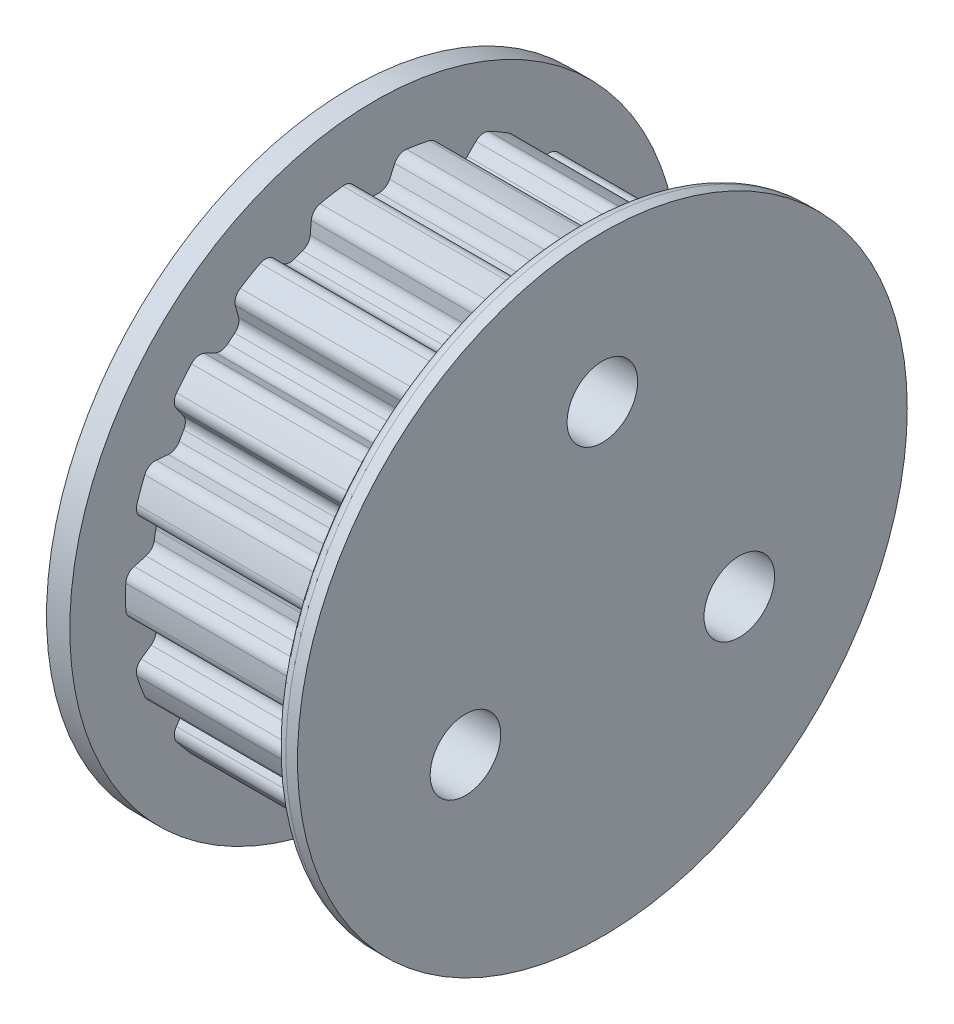
from build123d import *

# Parameters (mm, degrees)
SKETCH3_R                = 13.403127996
BOSS_EXTRUDE1_DEPTH      = 5.5
CUT_EXTRUDE1_DEPTH       = 5.5
FILLET1_R                = 0.61
CIRPATTERN1_COUNT        = 18
FILLET1_OF_CIRPATTERN1_R = 0.61
BOSS_EXTRUDE4_START      = 5.5
SKETCH8_R                = 16.403127996
BOSS_EXTRUDE4_DEPTH      = 1.25
BOSS_EXTRUDE5_START      = -6.75
SKETCH8_2_R              = 16.403127996
BOSS_EXTRUDE5_DEPTH      = 1.25
FILLET2_R                = 0.625
SKETCH10_R               = 6.35
CUT_EXTRUDE3_DEPTH       = 3.175
F_6_CLEARANCE_HOLE1_D    = 3.7973


with BuildPart() as part:
    # Sketch3 → Boss-Extrude1 (new, symmetric)
    with BuildSketch(Plane(origin=(0, 0, 0), x_dir=(0, 0, -1), z_dir=(1, 0, 0))):
        Circle(SKETCH3_R)
    extrude(amount=BOSS_EXTRUDE1_DEPTH, both=True)

    # Sketch4 → Cut-Extrude1 (cut, symmetric)
    with BuildSketch(Plane(origin=(0, 0, 0), x_dir=(0, 0, -1), z_dir=(1, 0, 0))):
        with BuildLine():
            Line((-1.267652297, 13.343046794), (-0.635, 11.986319564))
            ThreePointArc((-0.635, 11.986319564), (0, 12.003127996), (0.635, 11.986319564))
            Line((0.635, 11.986319564), (1.267652297, 13.343046794))
            ThreePointArc((1.267652297, 13.343046794), (0, 13.403127996), (-1.267652297, 13.343046794))
        make_face()
    cut_extrude1 = extrude(amount=CUT_EXTRUDE1_DEPTH, both=True, mode=Mode.SUBTRACT)

    # Fillet1
    fillet1_edges = [part.edges().sort_by_distance(p)[0] for p in [
        (0, 13.343046794, -1.267652297),
        (0, 11.986319564, -0.635),
        (0, 11.986319564, 0.635),
        (0, 13.343046794, 1.267652297),
    ]]
    fillet(fillet1_edges, radius=FILLET1_R)

    # CirPattern1: Cut-Extrude1 ×18 about axis
    cirpattern1_axis = Axis((0, 0, 0), (1, 0, 0))
    for i in range(1, CIRPATTERN1_COUNT):
        add(cut_extrude1.rotate(cirpattern1_axis, i * 360 / CIRPATTERN1_COUNT), mode=Mode.SUBTRACT)

    # Fillet1 of CirPattern1
    fillet1_of_cirpattern1_edges = [part.edges().sort_by_distance(p)[0] for p in [
        (0, 12.971925231, 3.372387267),
        (0, 11.480638836, 3.502857921),
        (0, 11.046273254, 4.69626755),
        (0, 12.104799991, 5.754794286),
        (0, 11.036198041, 7.605667156),
        (0, 9.590223628, 7.21821948),
        (0, 8.773883363, 8.191095923),
        (0, 9.406535661, 9.547823152),
        (0, 7.769342489, 10.921591339),
        (0, 6.543085914, 10.062957241),
        (0, 5.443233651, 10.697957241),
        (0, 5.573704304, 12.189243636),
        (0, 3.565389571, 12.92021042),
        (0, 2.706755472, 11.693953844),
        (0, 1.456049626, 11.91448703),
        (0, 1.06860195, 13.360461443),
        (0, -1.06860195, 13.360461443),
        (0, -1.456049626, 11.91448703),
        (0, -2.706755472, 11.693953844),
        (0, -3.565389571, 12.92021042),
        (0, -5.573704304, 12.189243636),
        (0, -5.443233651, 10.697957241),
        (0, -6.543085914, 10.062957241),
        (0, -7.769342489, 10.921591339),
        (0, -9.406535661, 9.547823152),
        (0, -8.773883363, 8.191095923),
        (0, -9.590223628, 7.21821948),
        (0, -11.036198041, 7.605667156),
        (0, -12.104799991, 5.754794286),
        (0, -11.046273254, 4.69626755),
        (0, -11.480638836, 3.502857921),
        (0, -12.971925231, 3.372387267),
        (0, -13.343046794, 1.267652297),
        (0, -11.986319564, 0.635),
        (0, -11.986319564, -0.635),
        (0, -13.343046794, -1.267652297),
        (0, -12.971925231, -3.372387267),
        (0, -11.480638836, -3.502857921),
        (0, -11.046273254, -4.69626755),
        (0, -12.104799991, -5.754794286),
        (0, -11.036198041, -7.605667156),
        (0, -9.590223628, -7.21821948),
        (0, -8.773883363, -8.191095923),
        (0, -9.406535661, -9.547823152),
        (0, -7.769342489, -10.921591339),
        (0, -6.543085914, -10.062957241),
        (0, -5.443233651, -10.697957241),
        (0, -5.573704304, -12.189243636),
        (0, -3.565389571, -12.92021042),
        (0, -2.706755472, -11.693953844),
        (0, -1.456049626, -11.91448703),
        (0, -1.06860195, -13.360461443),
        (0, 1.06860195, -13.360461443),
        (0, 1.456049626, -11.91448703),
        (0, 2.706755472, -11.693953844),
        (0, 3.565389571, -12.92021042),
        (0, 5.573704304, -12.189243636),
        (0, 5.443233651, -10.697957241),
        (0, 6.543085914, -10.062957241),
        (0, 7.769342489, -10.921591339),
        (0, 9.406535661, -9.547823152),
        (0, 8.773883363, -8.191095923),
        (0, 9.590223628, -7.21821948),
        (0, 11.036198041, -7.605667156),
        (0, 12.104799991, -5.754794286),
        (0, 11.046273254, -4.69626755),
        (0, 11.480638836, -3.502857921),
        (0, 12.971925231, -3.372387267),
    ]]
    fillet(fillet1_of_cirpattern1_edges, radius=FILLET1_OF_CIRPATTERN1_R)

    # Sketch8 → Boss-Extrude4 (add)
    with BuildSketch(Plane(origin=(0, 0, 0), x_dir=(0, 0, -1), z_dir=(1, 0, 0)).offset(BOSS_EXTRUDE4_START)):
        Circle(SKETCH8_R)
    extrude(amount=BOSS_EXTRUDE4_DEPTH)

    # Sketch8<2> → Boss-Extrude5 (add)
    with BuildSketch(Plane(origin=(0, 0, 0), x_dir=(0, 0, -1), z_dir=(1, 0, 0)).offset(BOSS_EXTRUDE5_START)):
        Circle(SKETCH8_2_R)
    extrude(amount=BOSS_EXTRUDE5_DEPTH)

    # Fillet2
    fillet2_edges = [part.edges().sort_by_distance(p)[0] for p in [
        (5.5, 0, 16.403127996),
    ]]
    fillet(fillet2_edges, radius=FILLET2_R)

    # Sketch10 → Cut-Extrude3 (cut)
    with BuildSketch(Plane.ZY.offset(6.75)):
        Circle(SKETCH10_R)
    extrude(amount=-CUT_EXTRUDE3_DEPTH, mode=Mode.SUBTRACT)

    # #6 Clearance Hole1 (through all)
    with Locations(Plane.ZY.offset(6.75)):
        with Locations((0, 8.505524166), (-7.366, -4.252762083), (7.366, -4.252762083)):
            Hole(F_6_CLEARANCE_HOLE1_D / 2)


solid = part.part
